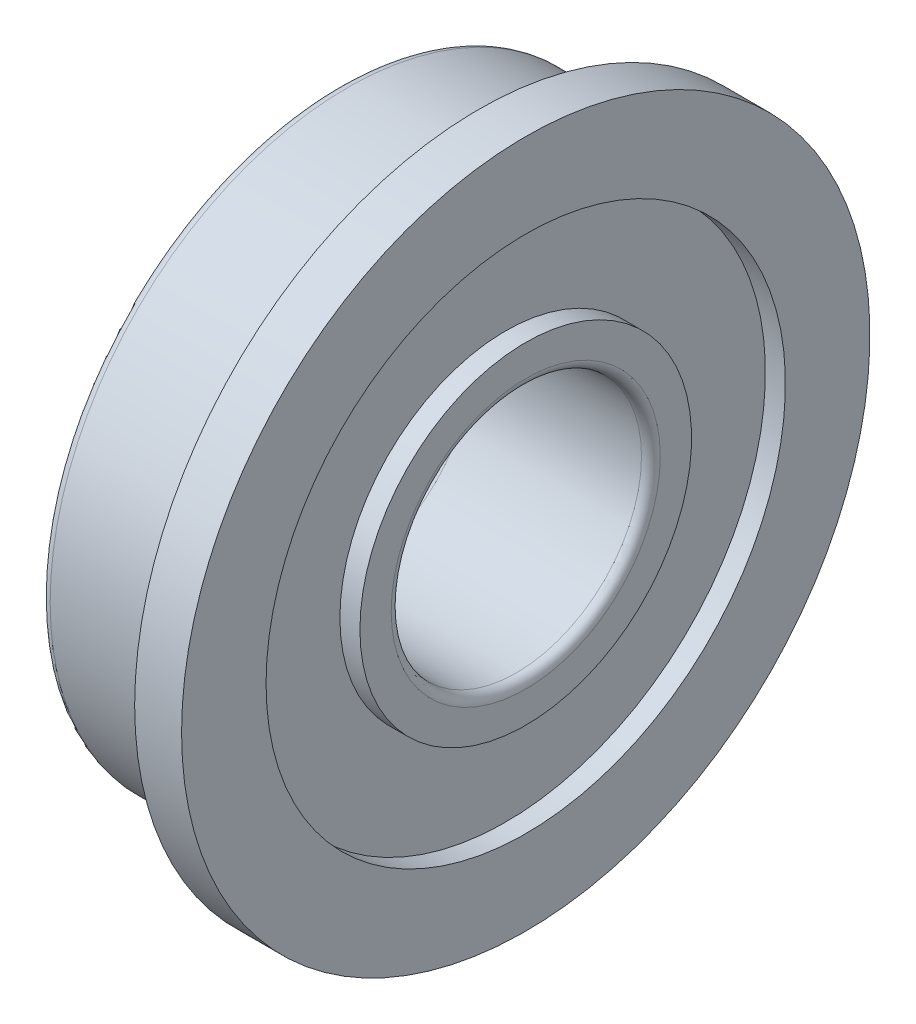
from build123d import *


with BuildPart() as part:
    # Sketch1 → Revolve1 (revolve)
    with BuildSketch(Plane.XY, mode=Mode.PRIVATE) as revolve1_sk:
        with BuildLine():
            Line((0, 9.2), (0, 8.3))
            Line((0, 8.3), (0.64, 8.3))
            Line((0.64, 8.3), (0.64, 5.3))
            Line((0.64, 5.3), (0, 5.3))
            Line((0, 5.3), (0, 4.3))
            ThreePointArc((0, 4.3), (0.087867966, 4.087867966), (0.3, 4))
            Line((0.3, 4), (5.7, 4))
            ThreePointArc((5.7, 4), (5.912132034, 4.087867966), (6, 4.3))
            Line((6, 4.3), (6, 5.3))
            Line((6, 5.3), (5.36, 5.3))
            Line((5.36, 5.3), (5.36, 8.3))
            Line((5.36, 8.3), (6, 8.3))
            Line((6, 8.3), (6, 11))
            Line((6, 11), (4.5, 11))
            Line((4.5, 11), (4.5, 9.8))
            ThreePointArc((4.5, 9.8), (4.712132034, 9.287867966), (4.2, 9.5))
            Line((4.2, 9.5), (0.3, 9.5))
            ThreePointArc((0.3, 9.5), (0.087867966, 9.412132034), (0, 9.2))
        make_face()
    revolve(revolve1_sk.sketch.rotate(Axis((19, 0, 0), (-1, 0, 0)), 270), axis=Axis((19, 0, 0), (-1, 0, 0)))


solid = part.part
